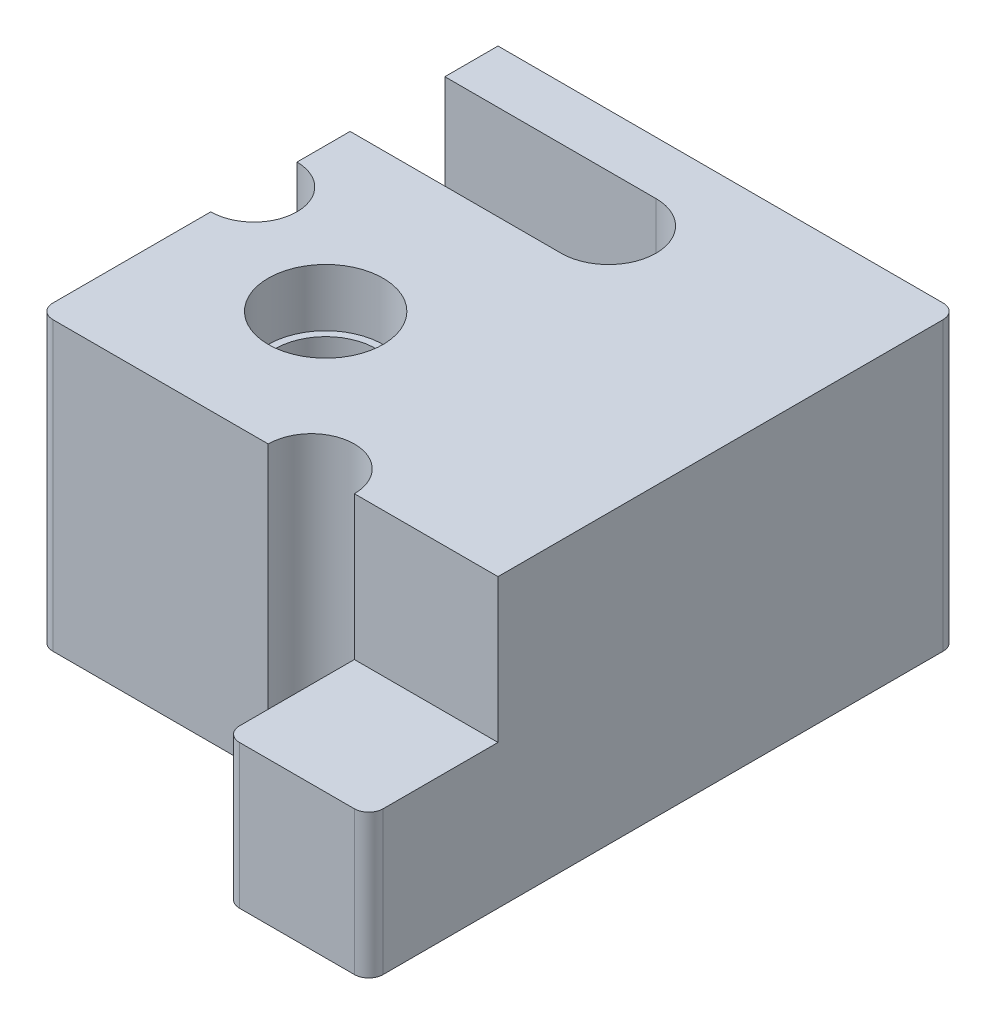
from build123d import *

# Parameters (mm, degrees)
BOSS_EXTRUDE1_DEPTH = 10
SKETCH4_R           = 1.75
CUT_EXTRUDE3_DEPTH  = 10
SKETCH6_R           = 2
CUT_EXTRUDE5_DEPTH  = 2
CUT_EXTRUDE6_DEPTH  = 29.447319733
SKETCH8_W           = 5
SKETCH8_H           = 4.5
SKETCH8_W_2         = 1
SKETCH8_H_2         = 7
CUT_EXTRUDE7_DEPTH  = 5
CUT_EXTRUDE8_DEPTH  = 9
FILLET6_R           = 0.5


with BuildPart() as part:
    # Sketch1 → Boss-Extrude1 (new body)
    with BuildSketch(Plane(origin=(0, 0, 0), x_dir=(1, 0, 0), z_dir=(0, 1, 0))):
        Polygon((0, 0), (17, 0), (17, -20.5), (12, -20.5), (12, -16), (1, -16), (1, -7), (0, -7), align=None)
    extrude(amount=BOSS_EXTRUDE1_DEPTH)

    # Sketch4 → Cut-Extrude3 (cut)
    with BuildSketch(Plane(origin=(0, 10, 0), x_dir=(1, 0, 0), z_dir=(0, 1, 0))):
        with Locations(Location((6, -11, 0), (0, 0, 270))):
            Circle(SKETCH4_R)
    extrude(amount=-CUT_EXTRUDE3_DEPTH, mode=Mode.SUBTRACT)

    # Sketch6 → Cut-Extrude5 (cut)
    with BuildSketch(Plane(origin=(0, 10, 0), x_dir=(1, 0, 0), z_dir=(0, 1, 0))):
        with Locations(Location((6, -11, 0), (0, 0, 270))):
            Circle(SKETCH6_R)
    extrude(amount=-CUT_EXTRUDE5_DEPTH, mode=Mode.SUBTRACT)

    # Sketch7 → Cut-Extrude6 (cut, through all)
    with BuildSketch(Plane.XZ):
        with BuildLine():
            Line((0, 10), (1, 10))
            ThreePointArc((1, 10), (2.5, 8.5), (1, 7))
            Line((1, 7), (0, 7))
            ThreePointArc((0, 7), (-1.5, 8.5), (0, 10))
        make_face()
        with BuildLine():
            Line((9, 16), (9, 20.5))
            ThreePointArc((9, 20.5), (10.5, 22), (12, 20.5))
            Line((12, 20.5), (12, 16))
            ThreePointArc((12, 16), (10.5, 14.5), (9, 16))
        make_face()
    extrude(amount=-CUT_EXTRUDE6_DEPTH, mode=Mode.SUBTRACT)

    # Sketch8 → Cut-Extrude7 (cut)
    with BuildSketch(Plane(origin=(0, 10, 0), x_dir=(1, 0, 0), z_dir=(0, 1, 0))):
        with Locations((14.5, -18.25)):
            Rectangle(SKETCH8_W, SKETCH8_H)
        with Locations((0.5, -3.5)):
            Rectangle(SKETCH8_W_2, SKETCH8_H_2)
    extrude(amount=-CUT_EXTRUDE7_DEPTH, mode=Mode.SUBTRACT)

    # Sketch9 → Cut-Extrude8 (cut)
    with BuildSketch(Plane(origin=(0, 10, 0), x_dir=(1, 0, 0), z_dir=(0, 1, 0))):
        with BuildLine():
            Line((8.35, -5.15), (0, -5.15))
            ThreePointArc((0, -5.15), (-1.65, -3.5), (0, -1.85))
            Line((0, -1.85), (8.35, -1.85))
            ThreePointArc((8.35, -1.85), (10, -3.5), (8.35, -5.15))
        make_face()
    extrude(amount=-CUT_EXTRUDE8_DEPTH, mode=Mode.SUBTRACT)

    # Fillet6
    fillet6_edges = [part.edges().sort_by_distance(p)[0] for p in [
        (0, 3, 1.85),
        (0, 3, 5.15),
        (1, 5, 16),
        (17, 5, 0),
        (17, 2.5, 20.5),
        (12, 2.5, 20.5),
        (0, 2.5, 7),
        (0, 2.5, 0),
    ]]
    fillet(fillet6_edges, radius=FILLET6_R)


solid = part.part
